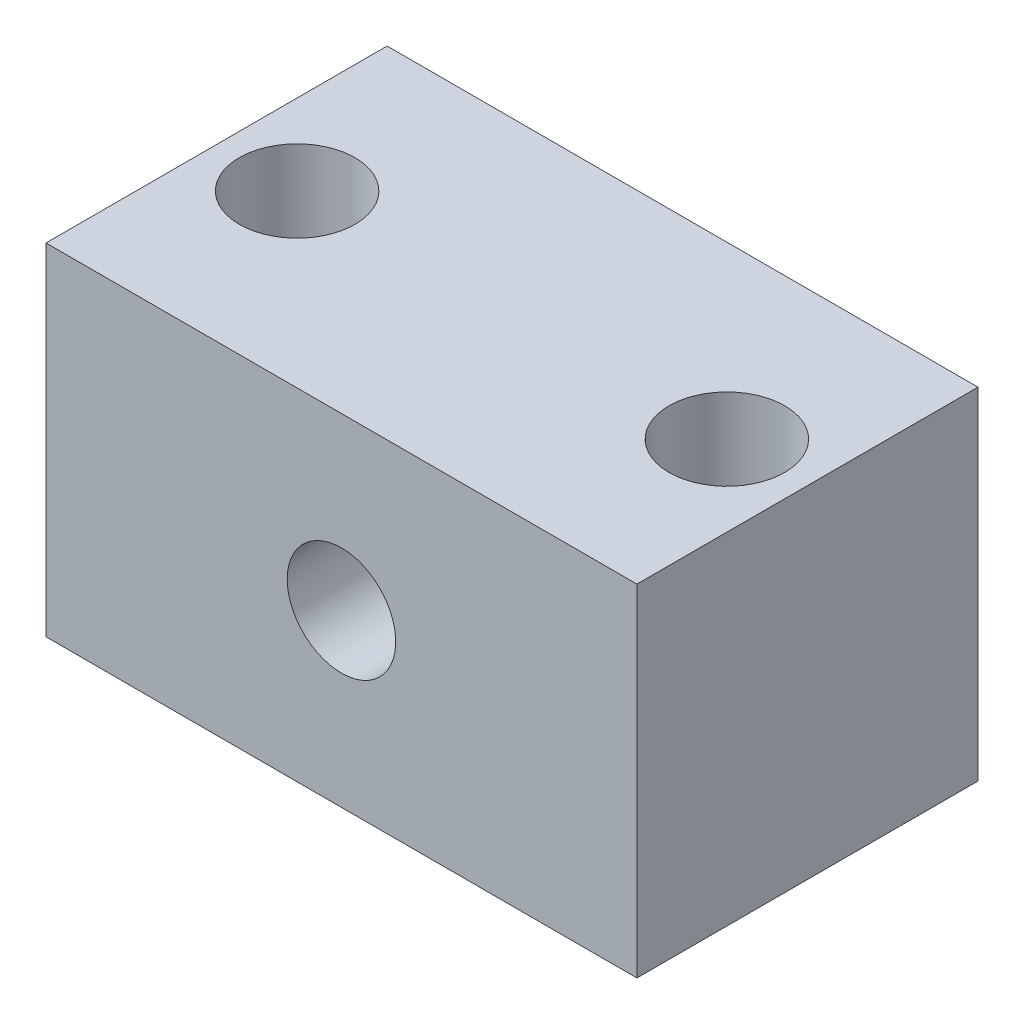
from build123d import *

# Parameters (mm, degrees)
SKETCH1_W                    = 22.000000004
SKETCH1_H                    = 12.7
BOSS_EXTRUDE1_DEPTH          = 6.35
F_18_0_1695_DIAMETER_HOLE1_D = 4.3053
F_18_0_1695_DIAMETER_HOLE2_D = 4.3053
F_10_32_TAPPED_HOLE1_D       = 4.0386


with BuildPart() as part:
    # Sketch1 → Boss-Extrude1 (new, symmetric)
    with BuildSketch(Plane(origin=(0, 0, 0), x_dir=(1, 0, 0), z_dir=(0, 1, 0))):
        with Locations((11.000000002, 6.35)):
            Rectangle(SKETCH1_W, SKETCH1_H)
    extrude(amount=BOSS_EXTRUDE1_DEPTH, both=True)

    # #18 (0.1695) Diameter Hole1 (through all)
    with Locations(Plane(origin=(3, 6.35, -6.35), x_dir=(0, 0, 1), z_dir=(0, 1, 0))):
        with Locations((0, 0)):
            Hole(F_18_0_1695_DIAMETER_HOLE1_D / 2)

    # #18 (0.1695) Diameter Hole2 (through all)
    with Locations(Plane(origin=(19.000000004, 6.35, -6.35), x_dir=(0, 0, 1), z_dir=(0, 1, 0))):
        with Locations((0, 0)):
            Hole(F_18_0_1695_DIAMETER_HOLE2_D / 2)

    # #10-32 Tapped Hole1 (through all)
    with Locations(Plane(origin=(11.000000002, 0, -12.7), x_dir=(-1, 0, 0), z_dir=(0, 0, -1))):
        with Locations((0, 0)):
            Hole(F_10_32_TAPPED_HOLE1_D / 2)


solid = part.part
